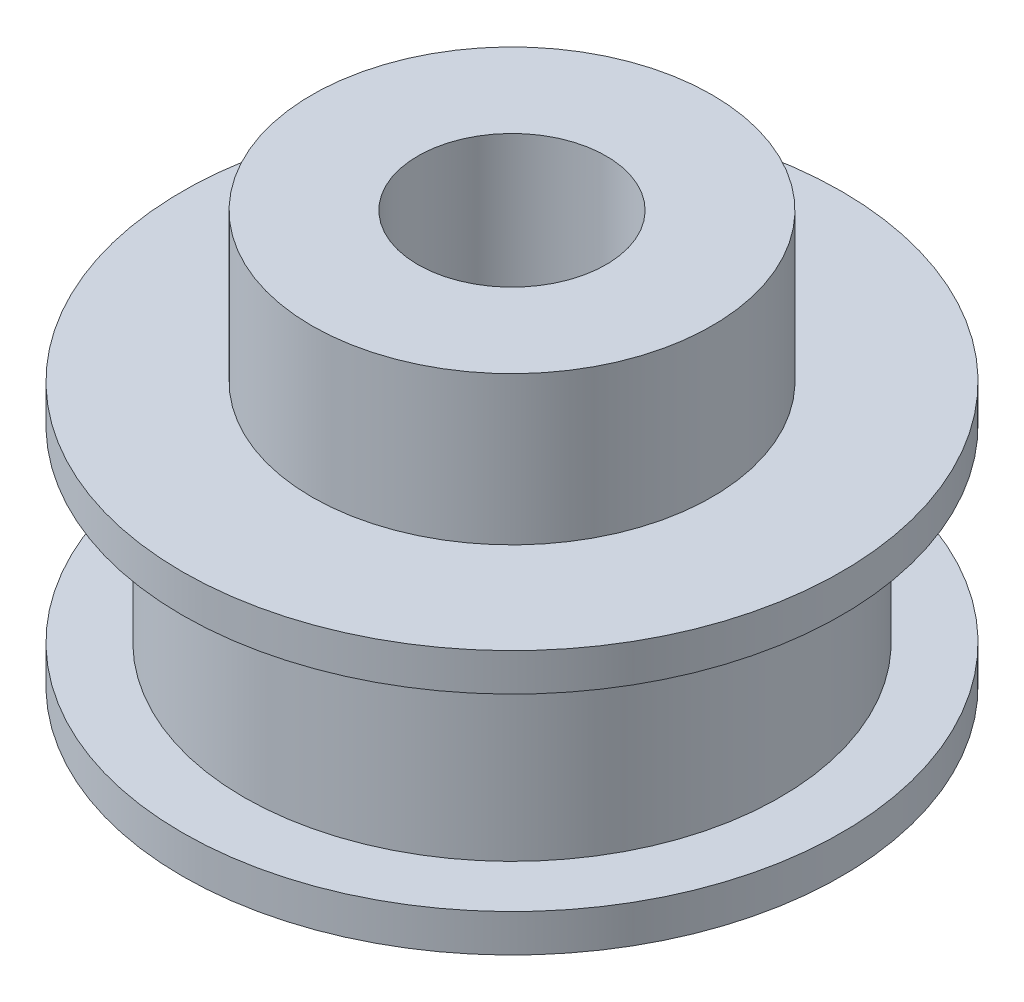
from build123d import *

# Parameters (mm, degrees)
SKETCH1_R               = 11.39
BOSS_EXTRUDE1_DEPTH     = 8
SKETCH2_R               = 14
BOSS_EXTRUDE2_DEPTH     = 1.6
SKETCH3_R               = 8.5
BOSS_EXTRUDE3_DEPTH     = 6.3
CUT_EXTRUDE1_DEPTH      = 26.393109302
CUT_EXTRUDE1_DEPTH_BACK = 26.393109302
SKETCH4_R               = 4
SKETCH5_R               = 14
SKETCH5_R_2             = 4
BOSS_EXTRUDE4_DEPTH     = 1.6


with BuildPart() as part:
    # Sketch1 → Boss-Extrude1 (new body)
    with BuildSketch(Plane(origin=(0, 0, 0), x_dir=(1, 0, 0), z_dir=(0, 1, 0))):
        with Locations(Location((0, 0, 0), (0, 0, 270))):
            Circle(SKETCH1_R)
    extrude(amount=BOSS_EXTRUDE1_DEPTH)

    # Sketch2 → Boss-Extrude2 (add)
    with BuildSketch(Plane(origin=(0, 8, 0), x_dir=(1, 0, 0), z_dir=(0, 1, 0))):
        with Locations(Location((0, 0, 0), (0, 0, 270))):
            Circle(SKETCH2_R)
    extrude(amount=BOSS_EXTRUDE2_DEPTH)

    # Sketch3 → Boss-Extrude3 (add)
    with BuildSketch(Plane(origin=(0, 9.6, 0), x_dir=(1, 0, 0), z_dir=(0, 1, 0))):
        with Locations(Location((0, 0, 0), (0, 0, 270))):
            Circle(SKETCH3_R)
    extrude(amount=BOSS_EXTRUDE3_DEPTH)

    # Sketch4 → Cut-Extrude1 (cut, two sides: drawn at the far end of the back side and taken through both)
    with BuildSketch(Plane(origin=(0, 15.9, 0), x_dir=(1, 0, 0), z_dir=(0, 1, 0)).offset(-CUT_EXTRUDE1_DEPTH_BACK)):
        with Locations(Location((0, 0, 0), (0, 0, 270))):
            Circle(SKETCH4_R)
    extrude(amount=CUT_EXTRUDE1_DEPTH + CUT_EXTRUDE1_DEPTH_BACK, mode=Mode.SUBTRACT)

    # Sketch5 → Boss-Extrude4 (add)
    with BuildSketch(Plane.XZ):
        with Locations(Location((0, 0, 0), (0, 0, 90))):
            Circle(SKETCH5_R)
        with Locations(Location((0, 0, 0), (0, 0, 90))):
            Circle(SKETCH5_R_2, mode=Mode.SUBTRACT)
    extrude(amount=BOSS_EXTRUDE4_DEPTH)


solid = part.part
